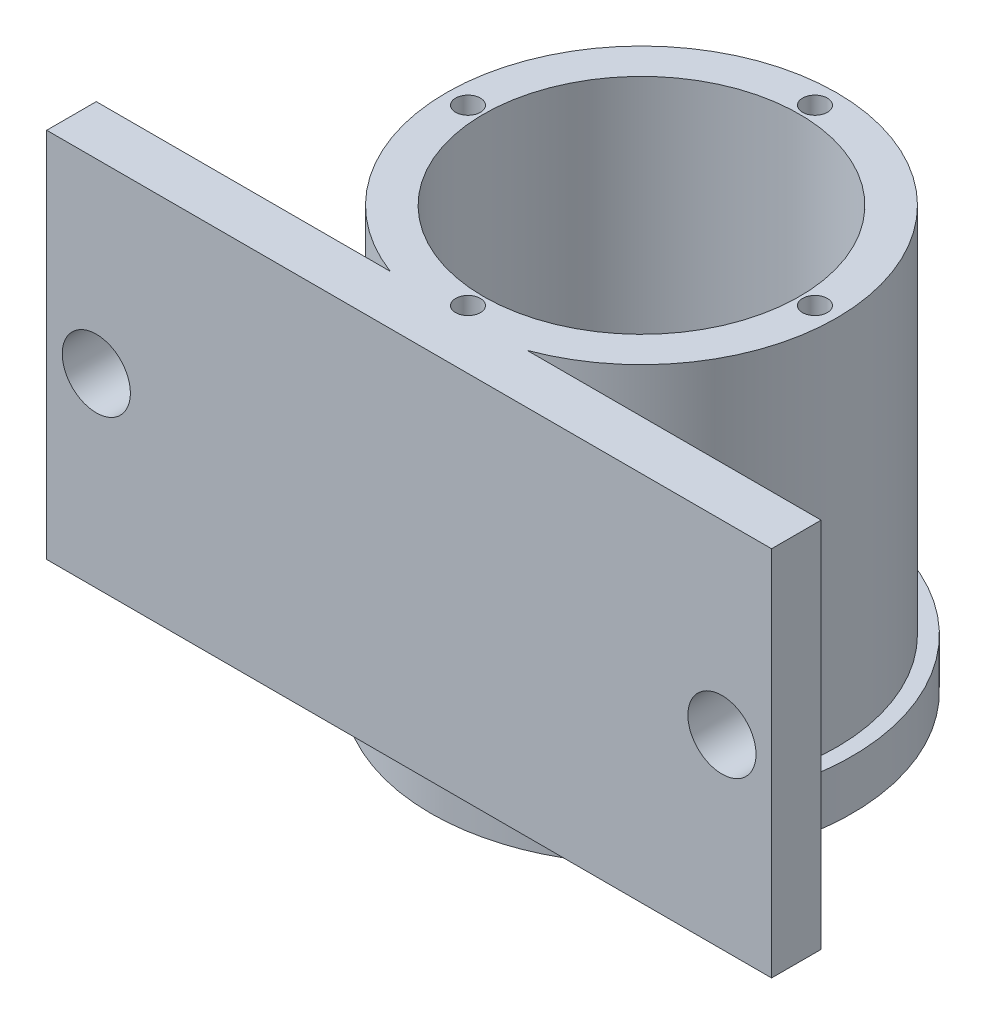
from build123d import *

# Parameters (mm, degrees)
SKETCH1_R                 = 17
BOSS_EXTRUDE2_DEPTH       = 4
SHELL1_T                  = -2
SKETCH14_R                = 15.75
BOSS_EXTRUDE7_DEPTH       = 30
SHELL4_T                  = -3
BOSS_EXTRUDE12_DEPTH      = 3
BOSS_EXTRUDE12_DEPTH_BACK = 1
SKETCH16_W                = 58.499045292
SKETCH16_H                = 30
SKETCH17_R                = 2.75
CUT_EXTRUDE4_DEPTH        = 5
SKETCH18_R                = 1
CUT_EXTRUDE5_DEPTH        = 7


with BuildPart() as part:
    # Sketch1 → Boss-Extrude2 (new body)
    with BuildSketch(Plane(origin=(0, 0, 0), x_dir=(1, 0, 0), z_dir=(0, 1, 0))):
        with Locations(Location((0, 0, 0), (0, 0, 270))):
            Circle(SKETCH1_R)
    extrude(amount=BOSS_EXTRUDE2_DEPTH)

    # Shell1
    shell1_openings = [part.faces().sort_by_distance(p)[0] for p in [
        (0, 0, 0),
    ]]
    offset(amount=SHELL1_T, openings=shell1_openings, kind=Kind.INTERSECTION)

    # Sketch14 → Boss-Extrude7 (add)
    with BuildSketch(Plane(origin=(0, 4, 0), x_dir=(1, 0, 0), z_dir=(0, 1, 0))):
        with Locations(Location((0, 0, 0), (0, 0, 270))):
            Circle(SKETCH14_R)
    extrude(amount=BOSS_EXTRUDE7_DEPTH)

    # Shell4
    shell4_openings = [part.faces().sort_by_distance(p)[0] for p in [
        (0, 34, 0),
    ]]
    offset(amount=SHELL4_T, openings=shell4_openings, kind=Kind.INTERSECTION)

    # Sketch16 → Boss-Extrude12 (add, two sides: drawn at the far end of the back side and taken through both)
    with BuildSketch(Plane.XY.offset(15.75).offset(-BOSS_EXTRUDE12_DEPTH_BACK)):
        with Locations((0, 19)):
            Rectangle(SKETCH16_W, SKETCH16_H)
    extrude(amount=BOSS_EXTRUDE12_DEPTH + BOSS_EXTRUDE12_DEPTH_BACK)

    # Sketch17 → Cut-Extrude4 (cut)
    with BuildSketch(Plane.XY.offset(18.75)):
        with Locations((-25.244673943, 19)):
            Circle(SKETCH17_R)
        with Locations((25.244673943, 19)):
            Circle(SKETCH17_R)
    extrude(amount=-CUT_EXTRUDE4_DEPTH, mode=Mode.SUBTRACT)

    # Sketch18 → Cut-Extrude5 (cut)
    with BuildSketch(Plane(origin=(0, 34, 0), x_dir=(1, 0, 0), z_dir=(0, 1, 0))):
        with Locations(Location((0, 14, 0), (0, 0, 270))):
            Circle(SKETCH18_R)
        with Locations(Location((14, 0, 0), (0, 0, 270))):
            Circle(SKETCH18_R)
        with Locations(Location((0, -14, 0), (0, 0, 270))):
            Circle(SKETCH18_R)
        with Locations(Location((-14, 0, 0), (0, 0, 270))):
            Circle(SKETCH18_R)
    extrude(amount=-CUT_EXTRUDE5_DEPTH, mode=Mode.SUBTRACT)


solid = part.part
